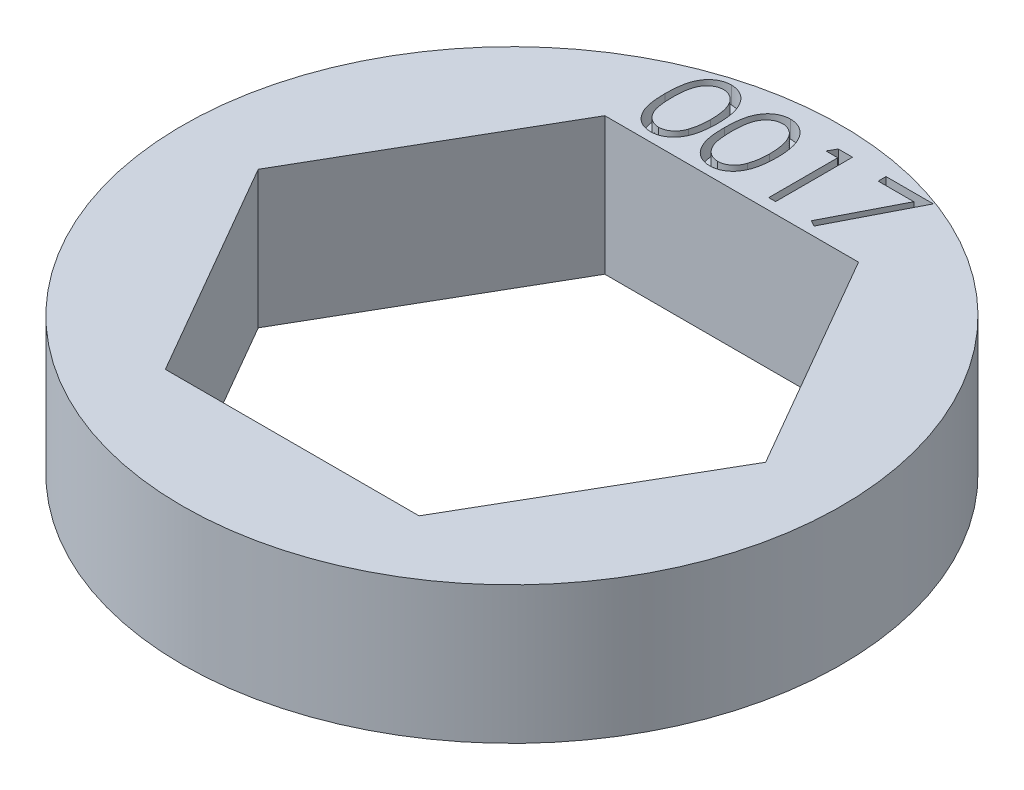
from build123d import *

# Parameters (mm, degrees)
SKETCH1_R           = 7.62
BOSS_EXTRUDE1_DEPTH = 3.175
CUT_EXTRUDE1_DEPTH  = 0.4


with BuildPart() as part:
    # Sketch1 → Boss-Extrude1 (new body)
    with BuildSketch(Plane(origin=(0, 0, 0), x_dir=(1, 0, 0), z_dir=(0, 1, 0))):
        with Locations(Location((0, 0, 0), (0, 0, 270))):
            Circle(SKETCH1_R)
        Polygon((5.865878735, 0), (2.932939367, 5.08), (-2.932939367, 5.08), (-5.865878735, 0), (-2.932939367, -5.08), (2.932939367, -5.08), align=None, mode=Mode.SUBTRACT)
    extrude(amount=BOSS_EXTRUDE1_DEPTH)

    # Sketch2 → Cut-Extrude1 (cut)
    # profile 1 of 4: a face of its own
    with BuildSketch(Plane(origin=(0, 3.175, 0), x_dir=(1, 0, 0), z_dir=(0, 1, 0))):
        with BuildLine():
            add(Edge.make_bspline(
                [(-2.679570558, 6.22228766), (-2.679403924, 6.250785133), (-2.679080237, 6.306141885), (-2.675479319, 6.386804483), (-2.669497445, 6.46247631), (-2.66129966, 6.533160988), (-2.651323566, 6.598876764), (-2.638006099, 6.659448021), (-2.622861195, 6.715155101), (-2.605308553, 6.766179662), (-2.585502756, 6.813209135), (-2.563946151, 6.857113137), (-2.539783236, 6.897825239), (-2.514394964, 6.935995236), (-2.486753632, 6.970998313), (-2.457645846, 7.003328786), (-2.425935533, 7.032239447), (-2.392700645, 7.058577368), (-2.357640281, 7.0816657), (-2.321753806, 7.102002331), (-2.284794213, 7.119375864), (-2.246660592, 7.133036205), (-2.207695692, 7.144319315), (-2.167763302, 7.152035301), (-2.126797489, 7.15689021), (-2.099146321, 7.157354354), (-2.085123042, 7.157589744)],
                knots=[0, 0, 0, 0, 1.646270934, 3.197905019, 4.663502075, 6.030701355, 7.308322542, 8.50163776, 9.611534131, 10.641858119, 11.616356847, 12.558055219, 13.465016945, 14.349605745, 15.204443733, 16.039544428, 16.859896111, 17.680448484, 18.487036065, 19.28249412, 20.06191084, 20.843045899, 21.620316918, 22.403196591, 23.190181807, 24, 24, 24, 24], degree=3))
            add(Edge.make_bspline(
                [(-2.085123042, 7.157589744), (-2.070982619, 7.157341933), (-2.042861766, 7.156849117), (-2.001286855, 7.152112554), (-1.960672417, 7.144253224), (-1.921191603, 7.133117369), (-1.88252011, 7.119301965), (-1.844960414, 7.101985709), (-1.808279217, 7.081828845), (-1.773059431, 7.058143915), (-1.738914406, 7.031736919), (-1.706682841, 7.001885483), (-1.676361801, 6.968891026), (-1.647570746, 6.933106559), (-1.621126503, 6.893845736), (-1.595943199, 6.851791408), (-1.573402205, 6.806208129), (-1.55169299, 6.757856451), (-1.532954401, 6.705398512), (-1.516055148, 6.649130014), (-1.502400632, 6.588386327), (-1.491026882, 6.523486154), (-1.482215675, 6.454191153), (-1.475798293, 6.380649865), (-1.472408365, 6.302813906), (-1.471769961, 6.249596919), (-1.471442353, 6.22228766)],
                knots=[0, 0, 0, 0, 0.810914788, 1.612654377, 2.396697861, 3.181598691, 3.963628158, 4.749916497, 5.551656086, 6.361998678, 7.18212741, 8.025565596, 8.878627764, 9.750805457, 10.657531673, 11.591944965, 12.560506719, 13.57287815, 14.630710178, 15.753379473, 16.941251878, 18.199788006, 19.531962791, 20.947069417, 22.433333509, 24, 24, 24, 24], degree=3))
            add(Edge.make_bspline(
                [(-1.471442353, 6.22228766), (-1.471773357, 6.195097515), (-1.472418307, 6.142118626), (-1.47576029, 6.06463289), (-1.482343275, 5.991481884), (-1.490577949, 5.922490169), (-1.501983038, 5.857944899), (-1.516006463, 5.797622719), (-1.531576826, 5.741263131), (-1.550796902, 5.689327847), (-1.571833543, 5.641092371), (-1.594721582, 5.59604946), (-1.619242654, 5.553800983), (-1.645957737, 5.514685112), (-1.67443287, 5.478424754), (-1.705277507, 5.445659962), (-1.737622164, 5.41560126), (-1.771867672, 5.388854234), (-1.80763674, 5.365443153), (-1.844191951, 5.344506517), (-1.882181909, 5.327624308), (-1.920745689, 5.313128507), (-1.960434899, 5.302053877), (-2.001200066, 5.294396359), (-2.042833834, 5.28902586), (-2.070977829, 5.288616168), (-2.085123042, 5.288410256)],
                knots=[0, 0, 0, 0, 1.561518951, 3.042555995, 4.452378317, 5.7783523, 7.031515105, 8.214008947, 9.334062868, 10.386615937, 11.391082383, 12.354592575, 13.286541444, 14.194233754, 15.072674879, 15.931287219, 16.775624067, 17.606195743, 18.42308326, 19.229000347, 20.022332153, 20.807536673, 21.593273796, 22.3848459, 23.188221202, 24, 24, 24, 24], degree=3))
            add(Edge.make_bspline(
                [(-2.085123042, 5.288410256), (-2.099145932, 5.288647165), (-2.126796333, 5.289114302), (-2.167767765, 5.293947278), (-2.207535247, 5.301717394), (-2.246295014, 5.312597029), (-2.284245923, 5.325914165), (-2.320870837, 5.343264237), (-2.35657698, 5.363245944), (-2.391269091, 5.386002018), (-2.424295269, 5.412073433), (-2.45584136, 5.440909691), (-2.48511487, 5.473230384), (-2.51236099, 5.508525169), (-2.538255827, 5.546469336), (-2.562075629, 5.58758095), (-2.584108023, 5.631696996), (-2.604246916, 5.679102495), (-2.622102437, 5.730489198), (-2.637874673, 5.786444981), (-2.650327865, 5.847463724), (-2.660987206, 5.913055346), (-2.669584793, 5.983501703), (-2.67545439, 6.058841038), (-2.679082178, 6.139026404), (-2.679404794, 6.19402745), (-2.679570558, 6.22228766)],
                knots=[0, 0, 0, 0, 0.810891512, 1.598919785, 2.382837074, 3.152667961, 3.926044502, 4.706494248, 5.493654104, 6.291793342, 7.103789334, 7.925228297, 8.761435821, 9.622817696, 10.50288917, 11.416980706, 12.369136599, 13.353924996, 14.394355917, 15.514179734, 16.714354668, 17.994756427, 19.357759367, 20.818452758, 22.365282078, 24, 24, 24, 24], degree=3))
        make_face()
        with BuildLine():
            add(Edge.make_bspline(
                [(-2.520006455, 6.223), (-2.519945776, 6.199251661), (-2.51982801, 6.153160798), (-2.51675146, 6.086184422), (-2.512560342, 6.023715495), (-2.507154563, 5.965674698), (-2.499126665, 5.912258492), (-2.490131617, 5.863099493), (-2.479185187, 5.818457856), (-2.466233718, 5.778027248), (-2.451481857, 5.741121522), (-2.435375278, 5.706780104), (-2.418072431, 5.674597321), (-2.398707903, 5.644862248), (-2.377618251, 5.617477916), (-2.355279835, 5.591959637), (-2.330858962, 5.569202771), (-2.297075061, 5.541909529), (-2.252474452, 5.513705809), (-2.196279261, 5.489145995), (-2.138535688, 5.473711707), (-2.099342853, 5.471748919), (-2.079780494, 5.470769231)],
                knots=[0, 0, 0, 0, 1.459021318, 2.831673884, 4.118529203, 5.306027144, 6.411944654, 7.436330062, 8.375795394, 9.233974572, 10.042671642, 10.816086306, 11.563610507, 12.285937304, 12.993564865, 13.685989202, 14.367179055, 15.041617293, 16.353048772, 17.594441528, 18.799311195, 20, 20, 20, 20], degree=3))
            add(Edge.make_bspline(
                [(-2.079780494, 5.470769231), (-2.060091596, 5.471580903), (-2.020754452, 5.473202573), (-1.963282484, 5.488848332), (-1.907488707, 5.512454858), (-1.863764161, 5.54036819), (-1.830499029, 5.566950982), (-1.806665198, 5.589615223), (-1.784789678, 5.614992804), (-1.764041904, 5.642373646), (-1.745012693, 5.672280868), (-1.727708619, 5.704570656), (-1.711918279, 5.739332679), (-1.702922083, 5.763599706), (-1.698322561, 5.776006811)],
                knots=[0, 0, 0, 0, 1.353760809, 2.704726607, 4.075137775, 5.516104923, 6.260822281, 7.007110065, 7.778089737, 8.566572457, 9.372053459, 10.217411131, 11.088608312, 12, 12, 12, 12], degree=3))
            add(Edge.make_bspline(
                [(-1.698322561, 5.776006811), (-1.692962263, 5.791871519), (-1.682078559, 5.824083679), (-1.668051778, 5.874052414), (-1.657005115, 5.926479418), (-1.647066925, 5.981051377), (-1.640283573, 6.038170746), (-1.634823684, 6.097660789), (-1.631607695, 6.159566361), (-1.631209041, 6.201626216), (-1.631006455, 6.223)],
                knots=[0, 0, 0, 0, 0.884706709, 1.796334032, 2.740027952, 3.714592787, 4.726048262, 5.777819803, 6.87074269, 8, 8, 8, 8], degree=3))
            add(Edge.make_bspline(
                [(-1.631006455, 6.223), (-1.631285951, 6.244370327), (-1.631832705, 6.286175255), (-1.633922611, 6.34739849), (-1.639319387, 6.405548113), (-1.645313339, 6.460874633), (-1.654151128, 6.513071787), (-1.663680094, 6.562576542), (-1.676482309, 6.608775598), (-1.690157555, 6.652392266), (-1.705809236, 6.692930998), (-1.723038429, 6.730580802), (-1.741439083, 6.765523442), (-1.761424941, 6.797663048), (-1.782758748, 6.82714358), (-1.806003583, 6.853373954), (-1.830237404, 6.877167134), (-1.864180534, 6.904326119), (-1.908617474, 6.93201806), (-1.963911063, 6.957502266), (-2.02145255, 6.972136879), (-2.060351864, 6.974200216), (-2.079780494, 6.975230769)],
                knots=[0, 0, 0, 0, 1.31362396, 2.569729283, 3.763502607, 4.902122613, 5.988968491, 7.01645872, 7.998833611, 8.933434873, 9.825090667, 10.667526885, 11.477055099, 12.250526234, 12.991942729, 13.710640831, 14.402115721, 15.076753259, 16.378508321, 17.609869233, 18.806226677, 20, 20, 20, 20], degree=3))
            add(Edge.make_bspline(
                [(-2.079780494, 6.975230769), (-2.099445474, 6.974198794), (-2.138811261, 6.972132965), (-2.196950822, 6.957556792), (-2.252680632, 6.932150205), (-2.297000064, 6.9042344), (-2.330966867, 6.877646538), (-2.354884875, 6.854590219), (-2.377311131, 6.829369922), (-2.397970322, 6.801733749), (-2.417319678, 6.772033342), (-2.435090033, 6.74003505), (-2.451100836, 6.705576717), (-2.465875781, 6.668687568), (-2.478866757, 6.628260448), (-2.48958249, 6.583673799), (-2.499481913, 6.534671158), (-2.50648991, 6.480965648), (-2.512719898, 6.422910314), (-2.516723623, 6.360285437), (-2.519838301, 6.293196731), (-2.519949281, 6.246867559), (-2.520006455, 6.223)],
                knots=[0, 0, 0, 0, 1.207732386, 2.417664972, 3.655092373, 4.956220595, 5.625982001, 6.301752483, 6.994047911, 7.697131622, 8.419323945, 9.170223765, 9.943494443, 10.752040957, 11.610060368, 12.549350801, 13.567764191, 14.679664412, 15.874934091, 17.154273443, 18.533957287, 20, 20, 20, 20], degree=3))
        make_face(mode=Mode.SUBTRACT)
    # profile 2 of 4: a face of its own
    with BuildSketch(Plane(origin=(0, 3.175, 0), x_dir=(1, 0, 0), z_dir=(0, 1, 0))):
        with BuildLine():
            add(Edge.make_bspline(
                [(-1.31187825, 6.22228766), (-1.311711617, 6.250785133), (-1.311387929, 6.306141885), (-1.307787011, 6.386804483), (-1.301805138, 6.46247631), (-1.293607352, 6.533160988), (-1.283631258, 6.598876764), (-1.270313791, 6.659448021), (-1.255168887, 6.715155101), (-1.237616245, 6.766179662), (-1.217810448, 6.813209135), (-1.196253844, 6.857113137), (-1.172090928, 6.897825239), (-1.146702656, 6.935995236), (-1.119061324, 6.970998313), (-1.089953538, 7.003328786), (-1.058243225, 7.032239447), (-1.025008337, 7.058577368), (-0.989947973, 7.0816657), (-0.954061499, 7.102002331), (-0.917101905, 7.119375864), (-0.878968284, 7.133036205), (-0.840003385, 7.144319315), (-0.800070995, 7.152035301), (-0.759105182, 7.15689021), (-0.731454013, 7.157354354), (-0.717430734, 7.157589744)],
                knots=[0, 0, 0, 0, 1.646270934, 3.197905019, 4.663502075, 6.030701355, 7.308322542, 8.50163776, 9.611534131, 10.641858119, 11.616356847, 12.558055219, 13.465016945, 14.349605745, 15.204443733, 16.039544428, 16.859896111, 17.680448484, 18.487036065, 19.28249412, 20.06191084, 20.843045899, 21.620316918, 22.403196591, 23.190181807, 24, 24, 24, 24], degree=3))
            add(Edge.make_bspline(
                [(-0.717430734, 7.157589744), (-0.703290311, 7.157341933), (-0.675169458, 7.156849117), (-0.633594548, 7.152112554), (-0.592980109, 7.144253224), (-0.553499295, 7.133117369), (-0.514827802, 7.119301965), (-0.477268107, 7.101985709), (-0.440586909, 7.081828845), (-0.405367123, 7.058143915), (-0.371222099, 7.031736919), (-0.338990533, 7.001885483), (-0.308669494, 6.968891026), (-0.279878439, 6.933106559), (-0.253434195, 6.893845736), (-0.228250892, 6.851791408), (-0.205709897, 6.806208129), (-0.184000682, 6.757856451), (-0.165262093, 6.705398512), (-0.148362841, 6.649130014), (-0.134708325, 6.588386327), (-0.123334574, 6.523486154), (-0.114523367, 6.454191153), (-0.108105985, 6.380649865), (-0.104716058, 6.302813906), (-0.104077653, 6.249596919), (-0.103750045, 6.22228766)],
                knots=[0, 0, 0, 0, 0.810914788, 1.612654377, 2.396697861, 3.181598691, 3.963628158, 4.749916497, 5.551656086, 6.361998678, 7.18212741, 8.025565596, 8.878627764, 9.750805457, 10.657531673, 11.591944965, 12.560506719, 13.57287815, 14.630710178, 15.753379473, 16.941251878, 18.199788006, 19.531962791, 20.947069417, 22.433333509, 24, 24, 24, 24], degree=3))
            add(Edge.make_bspline(
                [(-0.103750045, 6.22228766), (-0.10408105, 6.195097515), (-0.104725999, 6.142118626), (-0.108067982, 6.06463289), (-0.114650967, 5.991481884), (-0.122885641, 5.922490169), (-0.13429073, 5.857944899), (-0.148314155, 5.797622719), (-0.163884519, 5.741263131), (-0.183104594, 5.689327847), (-0.204141235, 5.641092371), (-0.227029275, 5.59604946), (-0.251550346, 5.553800983), (-0.278265429, 5.514685112), (-0.306740563, 5.478424754), (-0.337585199, 5.445659962), (-0.369929857, 5.41560126), (-0.404175364, 5.388854234), (-0.439944432, 5.365443153), (-0.476499643, 5.344506517), (-0.514489602, 5.327624308), (-0.553053382, 5.313128507), (-0.592742592, 5.302053877), (-0.633507758, 5.294396359), (-0.675141526, 5.28902586), (-0.703285521, 5.288616168), (-0.717430734, 5.288410256)],
                knots=[0, 0, 0, 0, 1.561518951, 3.042555995, 4.452378317, 5.7783523, 7.031515105, 8.214008947, 9.334062868, 10.386615937, 11.391082383, 12.354592575, 13.286541444, 14.194233754, 15.072674879, 15.931287219, 16.775624067, 17.606195743, 18.42308326, 19.229000347, 20.022332153, 20.807536673, 21.593273796, 22.3848459, 23.188221202, 24, 24, 24, 24], degree=3))
            add(Edge.make_bspline(
                [(-0.717430734, 5.288410256), (-0.731453624, 5.288647165), (-0.759104026, 5.289114302), (-0.800075458, 5.293947278), (-0.839842939, 5.301717394), (-0.878602706, 5.312597029), (-0.916553616, 5.325914165), (-0.953178529, 5.343264237), (-0.988884673, 5.363245944), (-1.023576783, 5.386002018), (-1.056602961, 5.412073433), (-1.088149052, 5.440909691), (-1.117422562, 5.473230384), (-1.144668683, 5.508525169), (-1.17056352, 5.546469336), (-1.194383321, 5.58758095), (-1.216415715, 5.631696996), (-1.236554608, 5.679102495), (-1.254410129, 5.730489198), (-1.270182365, 5.786444981), (-1.282635557, 5.847463724), (-1.293294898, 5.913055346), (-1.301892485, 5.983501703), (-1.307762082, 6.058841038), (-1.31138987, 6.139026404), (-1.311712486, 6.19402745), (-1.31187825, 6.22228766)],
                knots=[0, 0, 0, 0, 0.810891512, 1.598919785, 2.382837074, 3.152667961, 3.926044502, 4.706494248, 5.493654104, 6.291793342, 7.103789334, 7.925228297, 8.761435821, 9.622817696, 10.50288917, 11.416980706, 12.369136599, 13.353924996, 14.394355917, 15.514179734, 16.714354668, 17.994756427, 19.357759367, 20.818452758, 22.365282078, 24, 24, 24, 24], degree=3))
        make_face()
        with BuildLine():
            add(Edge.make_bspline(
                [(-1.152314147, 6.223), (-1.152253468, 6.199251661), (-1.152135702, 6.153160798), (-1.149059152, 6.086184422), (-1.144868034, 6.023715495), (-1.139462255, 5.965674698), (-1.131434357, 5.912258492), (-1.122439309, 5.863099493), (-1.11149288, 5.818457856), (-1.098541411, 5.778027248), (-1.083789549, 5.741121522), (-1.067682971, 5.706780104), (-1.050380123, 5.674597321), (-1.031015595, 5.644862248), (-1.009925943, 5.617477916), (-0.987587527, 5.591959637), (-0.963166654, 5.569202771), (-0.929382753, 5.541909529), (-0.884782144, 5.513705809), (-0.828586953, 5.489145995), (-0.77084338, 5.473711707), (-0.731650545, 5.471748919), (-0.712088186, 5.470769231)],
                knots=[0, 0, 0, 0, 1.459021318, 2.831673884, 4.118529203, 5.306027144, 6.411944654, 7.436330062, 8.375795394, 9.233974572, 10.042671642, 10.816086306, 11.563610507, 12.285937304, 12.993564865, 13.685989202, 14.367179055, 15.041617293, 16.353048772, 17.594441528, 18.799311195, 20, 20, 20, 20], degree=3))
            add(Edge.make_bspline(
                [(-0.712088186, 5.470769231), (-0.692399289, 5.471580903), (-0.653062144, 5.473202573), (-0.595590177, 5.488848332), (-0.539796399, 5.512454858), (-0.496071854, 5.54036819), (-0.462806722, 5.566950982), (-0.438972891, 5.589615223), (-0.41709737, 5.614992804), (-0.396349596, 5.642373646), (-0.377320386, 5.672280868), (-0.360016312, 5.704570656), (-0.344225971, 5.739332679), (-0.335229776, 5.763599706), (-0.330630253, 5.776006811)],
                knots=[0, 0, 0, 0, 1.353760809, 2.704726607, 4.075137775, 5.516104923, 6.260822281, 7.007110065, 7.778089737, 8.566572457, 9.372053459, 10.217411131, 11.088608312, 12, 12, 12, 12], degree=3))
            add(Edge.make_bspline(
                [(-0.330630253, 5.776006811), (-0.325269955, 5.791871519), (-0.314386251, 5.824083679), (-0.30035947, 5.874052414), (-0.289312807, 5.926479418), (-0.279374617, 5.981051377), (-0.272591265, 6.038170746), (-0.267131376, 6.097660789), (-0.263915387, 6.159566361), (-0.263516733, 6.201626216), (-0.263314147, 6.223)],
                knots=[0, 0, 0, 0, 0.884706709, 1.796334032, 2.740027952, 3.714592787, 4.726048262, 5.777819803, 6.87074269, 8, 8, 8, 8], degree=3))
            add(Edge.make_bspline(
                [(-0.263314147, 6.223), (-0.263593644, 6.244370327), (-0.264140398, 6.286175255), (-0.266230303, 6.34739849), (-0.271627079, 6.405548113), (-0.277621032, 6.460874633), (-0.28645882, 6.513071787), (-0.295987786, 6.562576542), (-0.308790002, 6.608775598), (-0.322465247, 6.652392266), (-0.338116928, 6.692930998), (-0.355346121, 6.730580802), (-0.373746775, 6.765523442), (-0.393732633, 6.797663048), (-0.41506644, 6.82714358), (-0.438311275, 6.853373954), (-0.462545096, 6.877167134), (-0.496488227, 6.904326119), (-0.540925166, 6.93201806), (-0.596218755, 6.957502266), (-0.653760242, 6.972136879), (-0.692659557, 6.974200216), (-0.712088186, 6.975230769)],
                knots=[0, 0, 0, 0, 1.31362396, 2.569729283, 3.763502607, 4.902122613, 5.988968491, 7.01645872, 7.998833611, 8.933434873, 9.825090667, 10.667526885, 11.477055099, 12.250526234, 12.991942729, 13.710640831, 14.402115721, 15.076753259, 16.378508321, 17.609869233, 18.806226677, 20, 20, 20, 20], degree=3))
            add(Edge.make_bspline(
                [(-0.712088186, 6.975230769), (-0.731753167, 6.974198794), (-0.771118953, 6.972132965), (-0.829258514, 6.957556792), (-0.884988325, 6.932150205), (-0.929307756, 6.9042344), (-0.963274559, 6.877646538), (-0.987192568, 6.854590219), (-1.009618823, 6.829369922), (-1.030278015, 6.801733749), (-1.049627371, 6.772033342), (-1.067397725, 6.74003505), (-1.083408529, 6.705576717), (-1.098183473, 6.668687568), (-1.111174449, 6.628260448), (-1.121890183, 6.583673799), (-1.131789606, 6.534671158), (-1.138797602, 6.480965648), (-1.14502759, 6.422910314), (-1.149031315, 6.360285437), (-1.152145994, 6.293196731), (-1.152256974, 6.246867559), (-1.152314147, 6.223)],
                knots=[0, 0, 0, 0, 1.207732386, 2.417664972, 3.655092373, 4.956220595, 5.625982001, 6.301752483, 6.994047911, 7.697131622, 8.419323945, 9.170223765, 9.943494443, 10.752040957, 11.610060368, 12.549350801, 13.567764191, 14.679664412, 15.874934091, 17.154273443, 18.533957287, 20, 20, 20, 20], degree=3))
        make_face(mode=Mode.SUBTRACT)
    # profile 3 of 4: a face of its own
    with BuildSketch(Plane(origin=(0, 3.175, 0), x_dir=(1, 0, 0), z_dir=(0, 1, 0))):
        Polygon((0.433710292, 7.112), (0.762455083, 7.112), (0.762455083, 5.334), (0.602890981, 5.334), (0.602890981, 6.929641026), (0.329352519, 6.929641026), align=None)
    # profile 4 of 4: a face of its own
    with BuildSketch(Plane(origin=(0, 3.175, 0), x_dir=(1, 0, 0), z_dir=(0, 1, 0))):
        Polygon((1.537480724, 7.112), (2.631634571, 7.112), (1.697044827, 5.288410256), (1.559207087, 5.364274439), (2.361657808, 6.929641026), (1.537480724, 6.929641026), align=None)
    extrude(amount=-CUT_EXTRUDE1_DEPTH, mode=Mode.SUBTRACT)


solid = part.part
